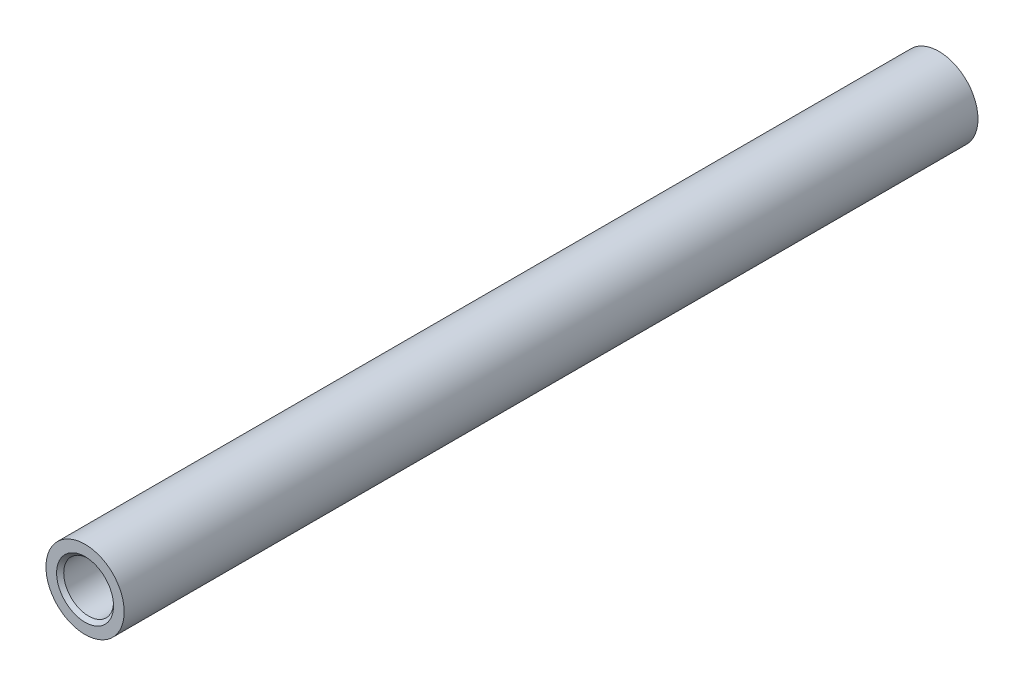
from build123d import *

# Parameters (mm, degrees)
SZKIC1_R                    = 11
SZKIC1_R_2                  = 7
DODANIE_WYCI_GNI_CIE1_DEPTH = 120
SZKIC2_R                    = 8
WYTNIJ_WYCI_GNI_CIE1_DEPTH  = 50
SFAZOWANIE1_SIZE            = 1


with BuildPart() as part:
    # Szkic1 → Dodanie-wyciągnięcie1 (new, symmetric)
    with BuildSketch(Plane.XY):
        Circle(SZKIC1_R)
        Circle(SZKIC1_R_2, mode=Mode.SUBTRACT)
    extrude(amount=DODANIE_WYCI_GNI_CIE1_DEPTH, both=True)

    # Szkic2 → Wytnij-wyciągnięcie1 (cut)
    with BuildSketch(Plane(origin=(0, 0, -120), x_dir=(-1, 0, 0), z_dir=(0, 0, -1))):
        Circle(SZKIC2_R)
    extrude(amount=-WYTNIJ_WYCI_GNI_CIE1_DEPTH, mode=Mode.SUBTRACT)

    # Sfazowanie1
    sfazowanie1_edges = [part.edges().sort_by_distance(p)[0] for p in [
        (-7, 0, 120),
    ]]
    chamfer(sfazowanie1_edges, length=SFAZOWANIE1_SIZE)


solid = part.part
